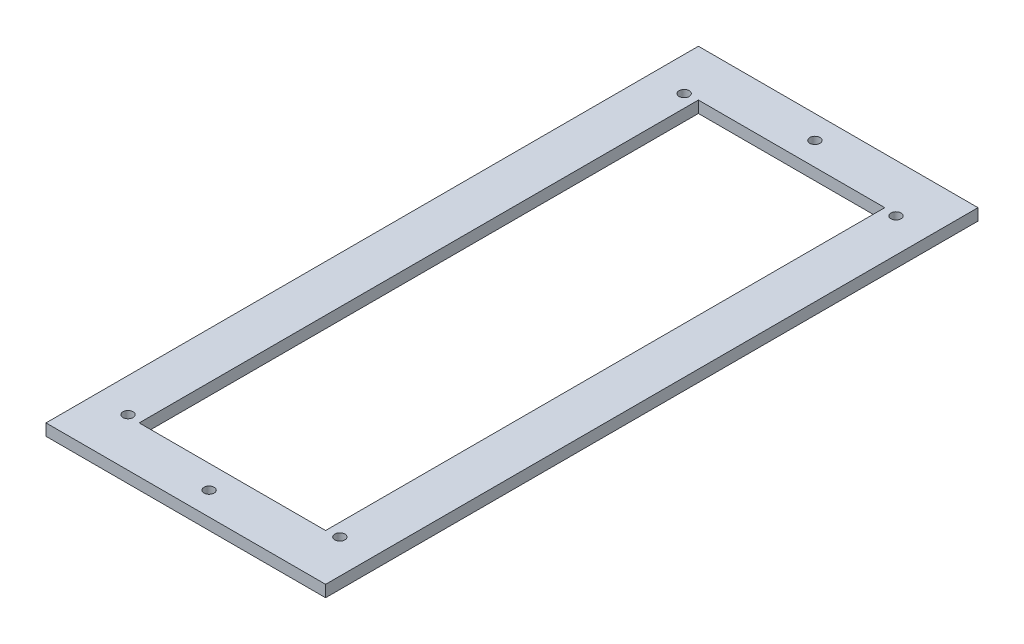
from build123d import *

# Parameters (mm, degrees)
SKETCH1_W           = 76.2
SKETCH1_H           = 177.8
BOSS_EXTRUDE1_DEPTH = 3.175
SKETCH2_R           = 1.3843
SKETCH2_W           = 50.8
SKETCH2_H           = 152.4
CUT_EXTRUDE1_DEPTH  = 182.864044344


with BuildPart() as part:
    # Sketch1 → Boss-Extrude1 (new body)
    with BuildSketch(Plane(origin=(0, 0, 0), x_dir=(1, 0, 0), z_dir=(0, 1, 0))):
        with Locations((0, -88.9)):
            Rectangle(SKETCH1_W, SKETCH1_H)
    extrude(amount=BOSS_EXTRUDE1_DEPTH)

    # Sketch2 → Cut-Extrude1 (cut, through all)
    with BuildSketch(Plane(origin=(0, 3.175, 0), x_dir=(1, 0, 0), z_dir=(0, 1, 0))):
        with Locations(Location((0, -6.35, 0), (0, 0, 270))):
            Circle(SKETCH2_R)
        with Locations(Location((0, -171.45, 0), (0, 0, 270))):
            Circle(SKETCH2_R)
        with Locations(Location((-28.8671, -13.1191, 0), (0, 0, 270))):
            Circle(SKETCH2_R)
        with Locations(Location((28.8671, -13.1191, 0), (0, 0, 270))):
            Circle(SKETCH2_R)
        with Locations(Location((-28.8671, -164.6809, 0), (0, 0, 270))):
            Circle(SKETCH2_R)
        with Locations(Location((28.8671, -164.6809, 0), (0, 0, 270))):
            Circle(SKETCH2_R)
        with Locations((0, -88.9)):
            Rectangle(SKETCH2_W, SKETCH2_H)
    extrude(amount=-CUT_EXTRUDE1_DEPTH, mode=Mode.SUBTRACT)


solid = part.part
